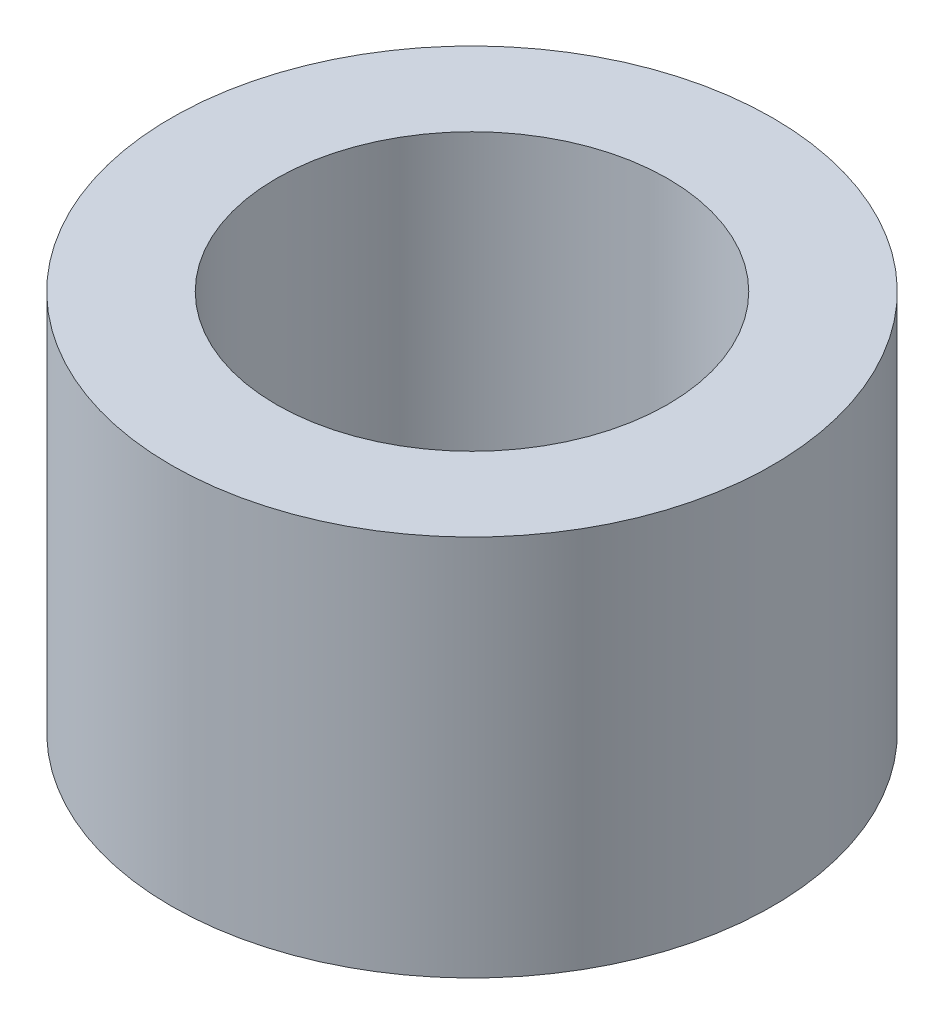
from build123d import *

# Parameters (mm, degrees)
SKETCH1_R           = 3.15
SKETCH1_R_2         = 2.05
BOSS_EXTRUDE1_DEPTH = 4


with BuildPart() as part:
    # Sketch1 → Boss-Extrude1 (new body)
    with BuildSketch(Plane(origin=(0, 0, 0), x_dir=(1, 0, 0), z_dir=(0, 1, 0))):
        with Locations(Location((0, 0, 0), (0, 0, 270))):
            Circle(SKETCH1_R)
        with Locations(Location((0, 0, 0), (0, 0, 270))):
            Circle(SKETCH1_R_2, mode=Mode.SUBTRACT)
    extrude(amount=BOSS_EXTRUDE1_DEPTH)


solid = part.part
